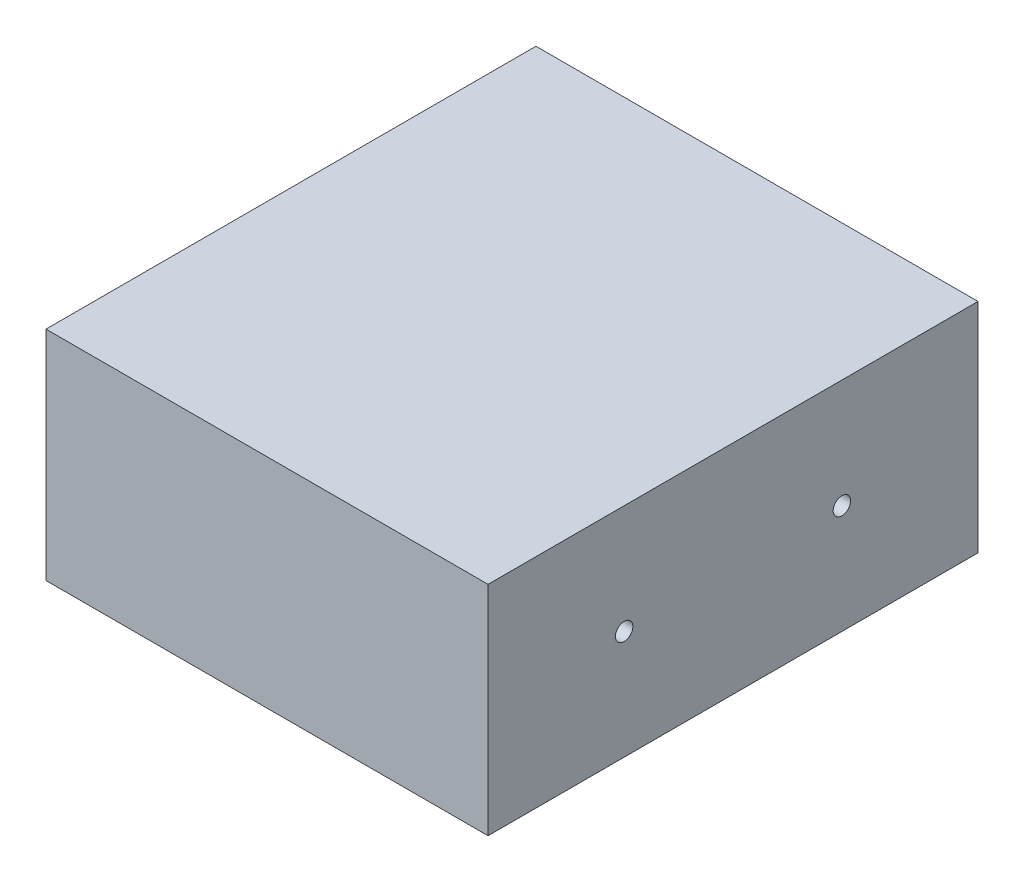
from build123d import *

# Parameters (mm, degrees)
SKETCH_1_W                  = 40.6
SKETCH_1_H                  = 45
EXTRUDE_1_DEPTH             = 20
HOLE_WIZARD_M2_1_AT_2_COUNT = 2
HOLE_WIZARD_M2_1_AT_2_PITCH = 20


with BuildPart() as part:
    # 草图1 → 凸台-拉伸1 (new body)
    with BuildSketch(Plane(origin=(0, 0, 0), x_dir=(1, 0, 0), z_dir=(0, 1, 0))):
        Rectangle(SKETCH_1_W, SKETCH_1_H)
    extrude(amount=EXTRUDE_1_DEPTH)

    # 草图3 → M2 螺纹孔的螺纹孔钻头1 (revolve, cut)
    with BuildSketch(Plane(origin=(20.3, 10, 10), x_dir=(0, 0, -1), z_dir=(0, 1, 0))):
        Polygon((0, 0), (0, 8.480688495), (0.8, 8), (0.8, 0), align=None)
    hole_wizard_m2_1 = revolve(axis=Axis((26.65, 10, 10), (-1, 0, 0)), mode=Mode.SUBTRACT)

    # M2 螺纹孔的螺纹孔钻头1 at 2: M2 螺纹孔的螺纹孔钻头1 ×2
    with Locations(*[(0, 0, -i * HOLE_WIZARD_M2_1_AT_2_PITCH) for i in range(1, HOLE_WIZARD_M2_1_AT_2_COUNT)]):
        add(hole_wizard_m2_1, mode=Mode.SUBTRACT)

    # 镜向1: M2 螺纹孔的螺纹孔钻头1 across plane
    add(hole_wizard_m2_1.mirror(Plane(origin=(0, 0, 0), x_dir=(0, 0, 1), z_dir=(1, 0, 0))), mode=Mode.SUBTRACT)

    # 镜向1 copy 1 sketch → 镜向1 copy 1 (revolve, cut)
    with BuildSketch(Plane(origin=(-20.3, 10, -10), x_dir=(0, 0, -1), z_dir=(0, 1, 0))):
        Polygon((0, 0), (0, -8.480688495), (0.8, -8), (0.8, 0), align=None)
    revolve(axis=Axis((-26.65, 10, -10), (-1, 0, 0)), mode=Mode.SUBTRACT)


solid = part.part
